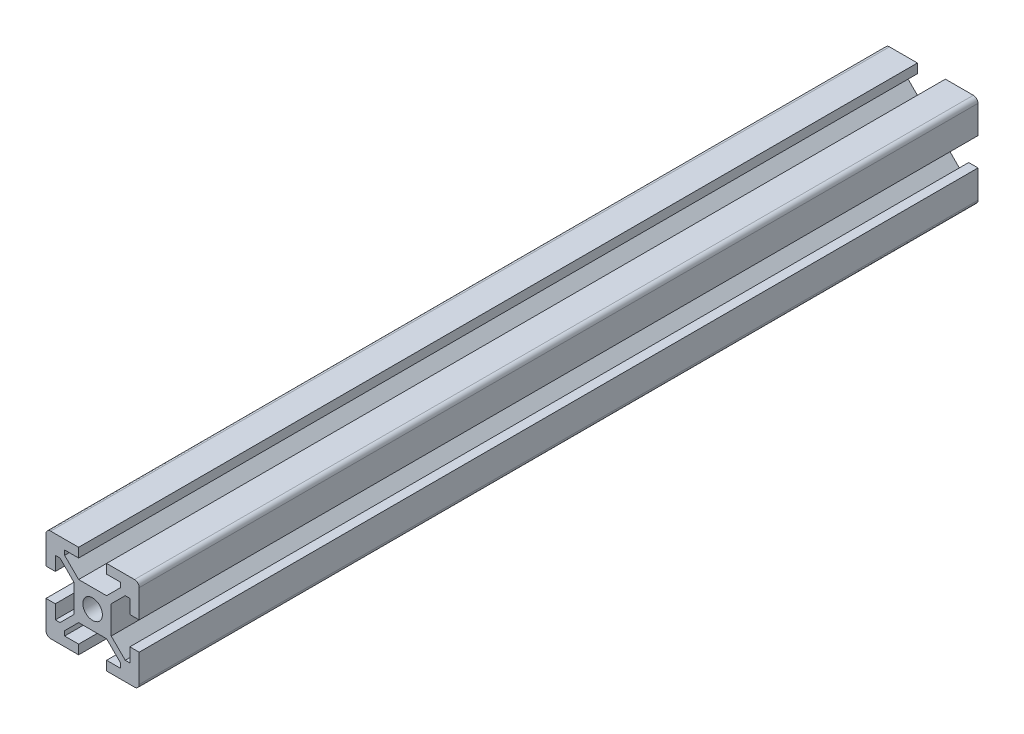
from build123d import *

# Parameters (mm, degrees)
SKETCH1_R           = 2.1
BOSS_EXTRUDE1_DEPTH = 180


with BuildPart() as part:
    # Sketch1 → Boss-Extrude1 (new body)
    with BuildSketch(Plane(origin=(0, 0, 0), x_dir=(-1, 0, 0), z_dir=(0, 0, -1))):
        with BuildLine():
            Line((6, -8), (3, -8))
            Line((3, -8), (3, -10))
            Line((3, -10), (9, -10))
            ThreePointArc((9, -10), (9.707106781, -9.707106781), (10, -9))
            Line((10, -9), (10, -3))
            Line((10, -3), (8, -3))
            Line((8, -3), (8, -6))
            Line((8, -6), (7, -6))
            Line((7, -6), (4, -3))
            Line((4, -3), (4, 3))
            Line((4, 3), (7, 6))
            Line((7, 6), (8, 6))
            Line((8, 6), (8, 3))
            Line((8, 3), (10, 3))
            Line((10, 3), (10, 9))
            ThreePointArc((10, 9), (9.707106781, 9.707106781), (9, 10))
            Line((9, 10), (3, 10))
            Line((3, 10), (3, 8))
            Line((3, 8), (6, 8))
            Line((6, 8), (6, 7))
            Line((6, 7), (3, 4))
            Line((3, 4), (-3, 4))
            Line((-3, 4), (-6, 7))
            Line((-6, 7), (-6, 8))
            Line((-6, 8), (-3, 8))
            Line((-3, 8), (-3, 10))
            Line((-3, 10), (-9, 10))
            ThreePointArc((-9, 10), (-9.707106781, 9.707106781), (-10, 9))
            Line((-10, 9), (-10, 3))
            Line((-10, 3), (-8, 3))
            Line((-8, 3), (-8, 6))
            Line((-8, 6), (-7, 6))
            Line((-7, 6), (-4, 3))
            Line((-4, 3), (-4, -3))
            Line((-4, -3), (-7, -6))
            Line((-7, -6), (-8, -6))
            Line((-8, -6), (-8, -3))
            Line((-8, -3), (-10, -3))
            Line((-10, -3), (-10, -9))
            ThreePointArc((-10, -9), (-9.707106781, -9.707106781), (-9, -10))
            Line((-9, -10), (-3, -10))
            Line((-3, -10), (-3, -8))
            Line((-3, -8), (-6, -8))
            Line((-6, -8), (-6, -7))
            Line((-6, -7), (-3, -4))
            Line((-3, -4), (3, -4))
            Line((3, -4), (6, -7))
            Line((6, -7), (6, -8))
        make_face()
        Circle(SKETCH1_R, mode=Mode.SUBTRACT)
    extrude(amount=-BOSS_EXTRUDE1_DEPTH)


solid = part.part
